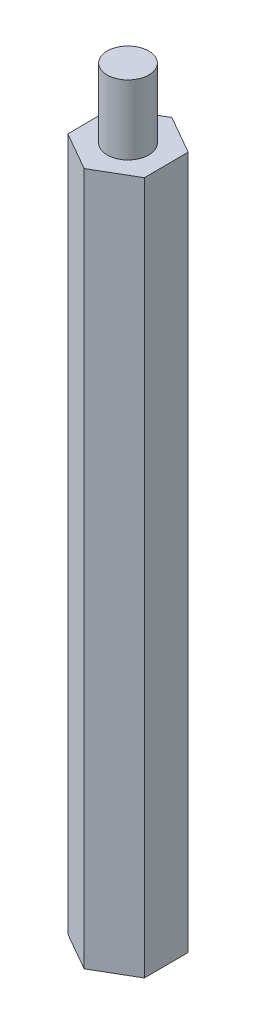
from build123d import *

# Parameters (mm, degrees)
SALIENTE_EXTRUIR1_DEPTH = 50
CROQUIS2_R              = 1.5
SALIENTE_EXTRUIR2_DEPTH = 5


with BuildPart() as part:
    # Croquis1 → Saliente-Extruir1 (new body)
    with BuildSketch(Plane(origin=(0, 0, 0), x_dir=(1, 0, 0), z_dir=(0, 1, 0))):
        Polygon((2.743476652, 1.598958785), (-0.013000601, 3.175399867), (-2.756477253, 1.576441083), (-2.743476652, -1.598958785), (0.013000601, -3.175399867), (2.756477253, -1.576441083), align=None)
    extrude(amount=SALIENTE_EXTRUIR1_DEPTH)

    # Croquis2 → Saliente-Extruir2 (add)
    with BuildSketch(Plane(origin=(0, 50, 0), x_dir=(1, 0, 0), z_dir=(0, 1, 0))):
        with Locations(Location((0, 0, 0), (0, 0, 270))):
            Circle(CROQUIS2_R)
    extrude(amount=SALIENTE_EXTRUIR2_DEPTH)


solid = part.part
